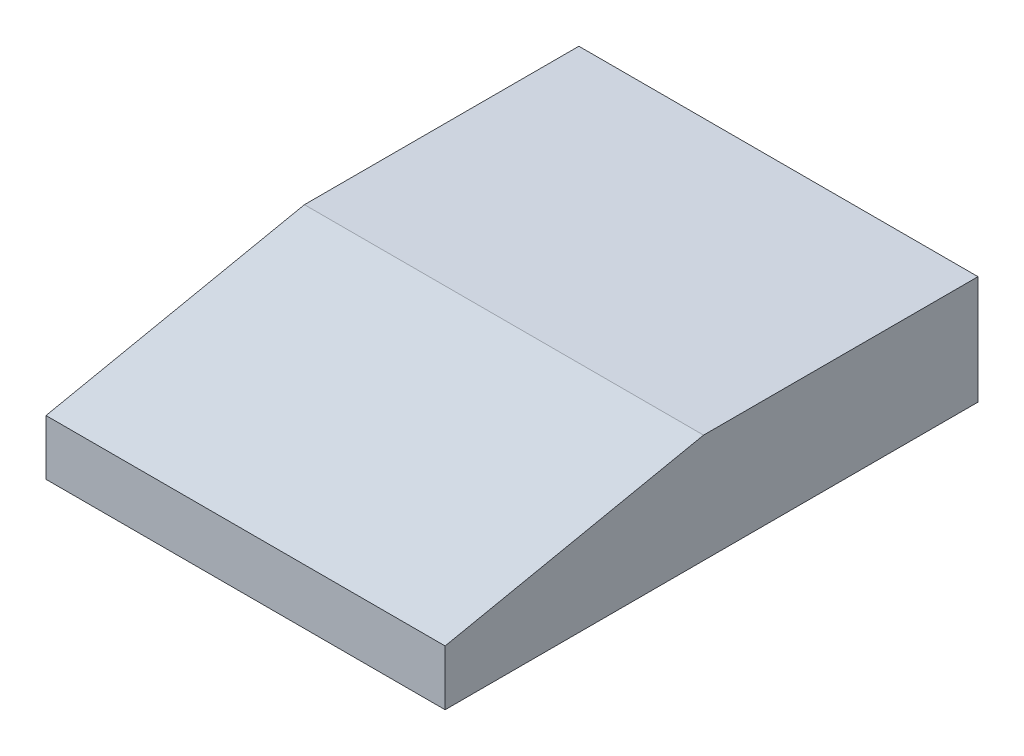
from build123d import *

# Parameters (mm, degrees)
BOSS_EXTRUDE1_DEPTH = 48


with BuildPart() as part:
    # Sketch1 → Boss-Extrude1 (new body)
    with BuildSketch(Plane(origin=(0, 0, 0), x_dir=(0, 0, -1), z_dir=(1, 0, 0))):
        Polygon((0, 0), (-64.084526643, 0), (-64.084526643, 6.646879678), (-33.006752416, 13.066701584), (0, 13.066701584), align=None)
    extrude(amount=BOSS_EXTRUDE1_DEPTH)


solid = part.part
